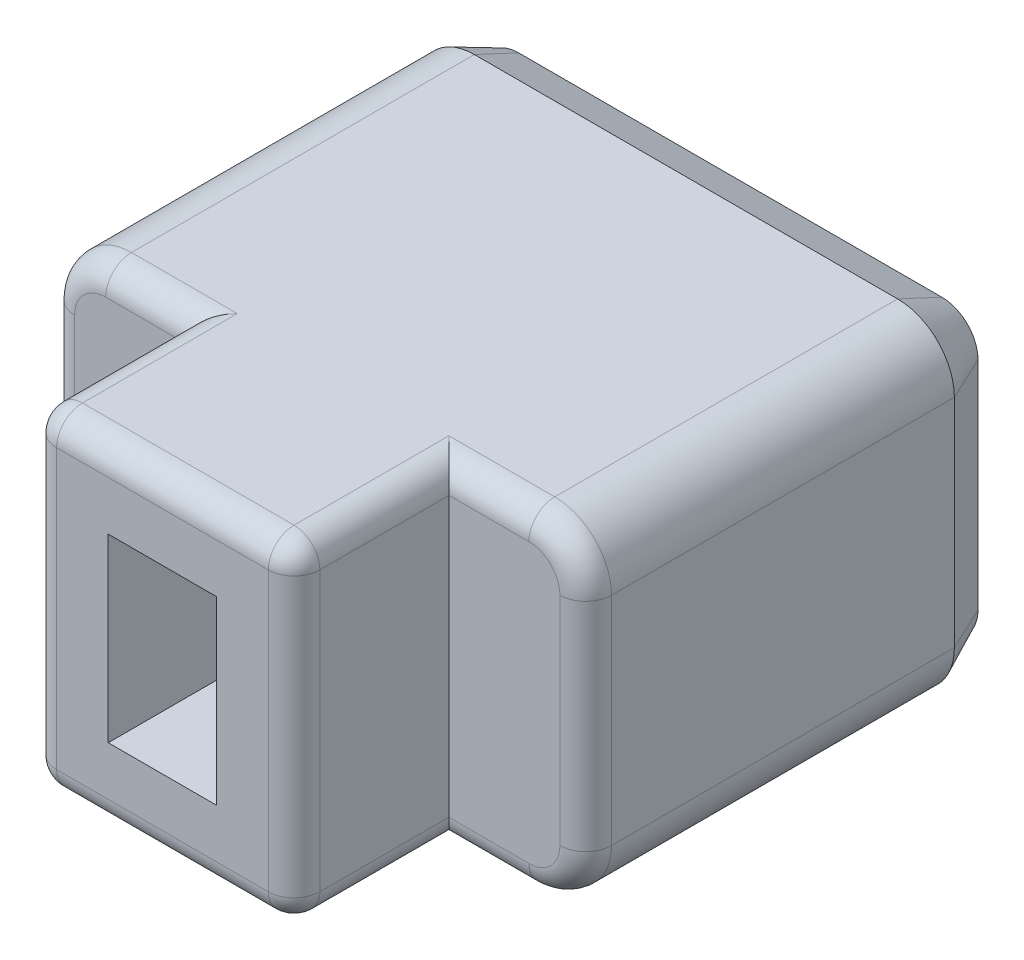
from build123d import *

# Parameters (mm, degrees)
BOSS_EXTRU_1_DEPTH      = 11
ESQUISSE3_W             = 2.1
ESQUISSE3_H             = 3.5
ENL_V_MAT_EXTRU_1_DEPTH = 3
ESQUISSE4_OUTSIDE_W     = 15.688
ESQUISSE4_OUTSIDE_H     = 11.688
ESQUISSE4_OUTSIDE_W_2   = 5.1
ESQUISSE4_OUTSIDE_H_2   = 6.4
ENL_V_MAT_EXTRU_2_DEPTH = 3
CONG_1_R                = 0.5
CHANFREIN1_SIZE         = 0.4
CHANFREIN1_SIZE2        = 0.857802768
ENL_V_MAT_EXTRU_3_DEPTH = 0.3
BOSS_EXTRU_2_DEPTH      = 0.3


with BuildPart() as part:
    # Esquisse2 → Boss.-Extru.1 (new body)
    with BuildSketch(Plane.XY):
        with BuildLine():
            Line((1.1, 0), (9.3, 0))
            ThreePointArc((9.3, 0), (10.077817459, 0.322182541), (10.4, 1.1))
            Line((10.4, 1.1), (10.4, 5.3))
            ThreePointArc((10.4, 5.3), (10.077817459, 6.077817459), (9.3, 6.4))
            Line((9.3, 6.4), (1.1, 6.4))
            ThreePointArc((1.1, 6.4), (0.322182541, 6.077817459), (0, 5.3))
            Line((0, 5.3), (0, 1.1))
            ThreePointArc((0, 1.1), (0.322182541, 0.322182541), (1.1, 0))
        make_face()
    extrude(amount=BOSS_EXTRU_1_DEPTH)

    # Esquisse3 → Enlèv. mat.-Extru.1 (cut)
    with BuildSketch(Plane.XY.offset(11)):
        with Locations((5.2, 3.2)):
            Rectangle(ESQUISSE3_W, ESQUISSE3_H)
    extrude(amount=-ENL_V_MAT_EXTRU_1_DEPTH, mode=Mode.SUBTRACT)

    # Esquisse4 outside → Enlèv. mat.-Extru.2 (cut)
    with BuildSketch(Plane.XY.offset(11)):
        with Locations((5.2, 3.2)):
            Rectangle(ESQUISSE4_OUTSIDE_W, ESQUISSE4_OUTSIDE_H)
        with Locations((5.2, 3.2)):
            Rectangle(ESQUISSE4_OUTSIDE_W_2, ESQUISSE4_OUTSIDE_H_2, mode=Mode.SUBTRACT)
    extrude(amount=-ENL_V_MAT_EXTRU_2_DEPTH, mode=Mode.SUBTRACT)

    # Congé1
    cong_1_edges = [part.edges().sort_by_distance(p)[0] for p in [
        (8.525, 0, 8),
        (10.077817459, 0.322182541, 8),
        (10.4, 3.2, 8),
        (10.077817459, 6.077817459, 8),
        (1.875, 6.4, 8),
        (0.322182541, 6.077817459, 8),
        (1.875, 0, 8),
        (0.322182541, 0.322182541, 8),
        (7.75, 6.4, 9.5),
        (2.65, 6.4, 9.5),
        (7.75, 0, 9.5),
        (2.65, 0, 9.5),
        (2.65, 3.2, 11),
        (5.2, 6.4, 11),
        (7.75, 3.2, 11),
        (5.2, 0, 11),
        (8.525, 6.4, 8),
        (0, 3.2, 8),
    ]]
    fillet(cong_1_edges, radius=CONG_1_R)

    # Chanfrein1
    chanfrein1_edges = [part.edges().sort_by_distance(p)[0] for p in [
        (5.2, 0, 0),
        (10.077817459, 0.322182541, 0),
        (0.322182541, 0.322182541, 0),
        (10.4, 3.2, 0),
        (0, 3.2, 0),
        (10.077817459, 6.077817459, 0),
        (0.322182541, 6.077817459, 0),
        (5.2, 6.4, 0),
    ]]
    chanfrein1_side = [part.faces().sort_by_distance(p)[0] for p in [
        (5.2, 3.2, 0),
    ]]
    chamfer(chanfrein1_edges, length=CHANFREIN1_SIZE, length2=CHANFREIN1_SIZE2, reference=chanfrein1_side[0])

    # Esquisse5 → Enlèv. mat.-Extru.3 (cut)
    with BuildSketch(Plane(origin=(0, 0, 0), x_dir=(-1, 0, 0), z_dir=(0, 0, -1))):
        Polygon((-4.225641026, 1.3), (-6.430769231, 1.3), (-4.584615385, 5.402564103), (-4.260897436, 5.225480769), (-5.842628205, 1.71025641), (-4.225641026, 1.71025641), align=None)
    extrude(amount=-ENL_V_MAT_EXTRU_3_DEPTH, mode=Mode.SUBTRACT)


with BuildPart() as body_2:
    # Esquisse5<2> → Boss.-Extru.2 (new body)
    with BuildSketch(Plane(origin=(0, 0, 0), x_dir=(-1, 0, 0), z_dir=(0, 0, -1))):
        Polygon((-4.225641026, 1.3), (-6.430769231, 1.3), (-4.584615385, 5.402564103), (-4.260897436, 5.225480769), (-5.842628205, 1.71025641), (-4.225641026, 1.71025641), align=None)
    extrude(amount=BOSS_EXTRU_2_DEPTH)


solid = Compound([part.part, body_2.part])
